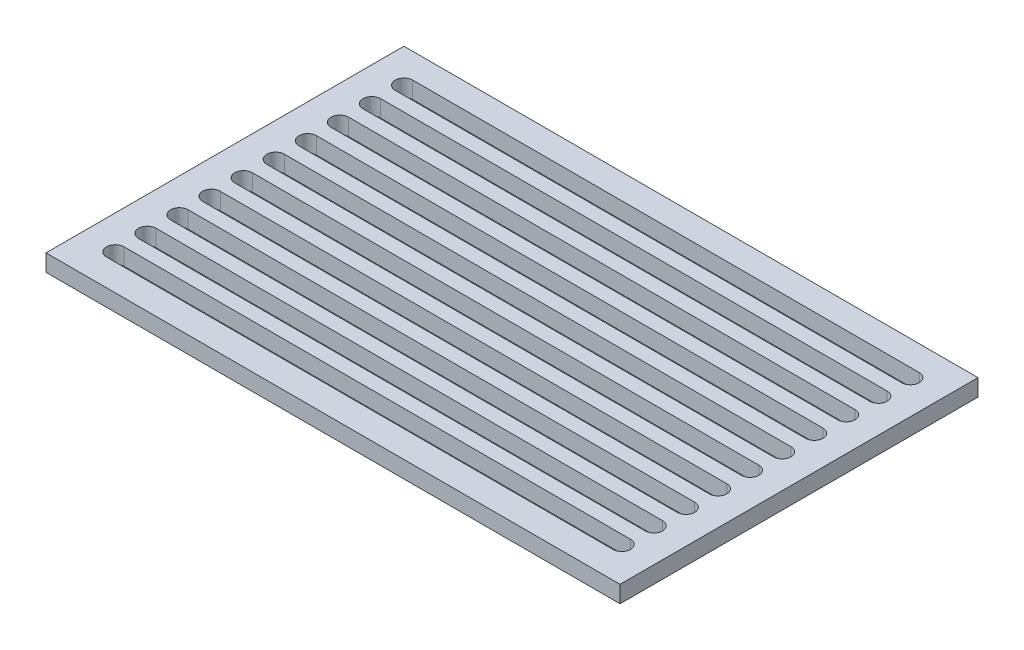
from build123d import *

# Parameters (mm, degrees)
SKETCH1_W           = 170
SKETCH1_H           = 106
BOSS_EXTRUDE1_DEPTH = 5
CUT_EXTRUDE2_REACH  = 202.402


with BuildPart() as part:
    # Sketch1 → Boss-Extrude1 (new body)
    with BuildSketch(Plane(origin=(0, 0, 0), x_dir=(1, 0, 0), z_dir=(0, 1, 0))):
        with Locations((85, 53)):
            Rectangle(SKETCH1_W, SKETCH1_H)
    extrude(amount=BOSS_EXTRUDE1_DEPTH)

    # Sketch2 → Cut-Extrude2 (cut, up to next)
    with BuildSketch(Plane(origin=(0, 5, 0), x_dir=(1, 0, 0), z_dir=(0, 1, 0)), mode=Mode.PRIVATE) as cut_extrude2_sk1:
        with BuildLine():
            Line((10, 98.605263158), (160, 98.605263158))
            ThreePointArc((160, 98.605263158), (162.605263158, 96), (160, 93.394736842))
            Line((160, 93.394736842), (10, 93.394736842))
            ThreePointArc((10, 93.394736842), (7.394736842, 96), (10, 98.605263158))
        make_face()
    cut_extrude2_tool1 = extrude(cut_extrude2_sk1.sketch, amount=-CUT_EXTRUDE2_REACH, mode=Mode.PRIVATE) & part.part
    # Sketch2 → Cut-Extrude2 (cut, up to next)
    with BuildSketch(Plane(origin=(0, 5, 0), x_dir=(1, 0, 0), z_dir=(0, 1, 0)), mode=Mode.PRIVATE) as cut_extrude2_sk2:
        with BuildLine():
            Line((10, 89.105263158), (160, 89.105263158))
            ThreePointArc((160, 89.105263158), (162.605263158, 86.5), (160, 83.894736842))
            Line((160, 83.894736842), (10, 83.894736842))
            ThreePointArc((10, 83.894736842), (7.394736842, 86.5), (10, 89.105263158))
        make_face()
    cut_extrude2_tool2 = extrude(cut_extrude2_sk2.sketch, amount=-CUT_EXTRUDE2_REACH, mode=Mode.PRIVATE) & part.part
    # Sketch2 → Cut-Extrude2 (cut, up to next)
    with BuildSketch(Plane(origin=(0, 5, 0), x_dir=(1, 0, 0), z_dir=(0, 1, 0)), mode=Mode.PRIVATE) as cut_extrude2_sk3:
        with BuildLine():
            Line((10, 79.605263158), (160, 79.605263158))
            ThreePointArc((160, 79.605263158), (162.605263158, 77), (160, 74.394736842))
            Line((160, 74.394736842), (10, 74.394736842))
            ThreePointArc((10, 74.394736842), (7.394736842, 77), (10, 79.605263158))
        make_face()
    cut_extrude2_tool3 = extrude(cut_extrude2_sk3.sketch, amount=-CUT_EXTRUDE2_REACH, mode=Mode.PRIVATE) & part.part
    # Sketch2 → Cut-Extrude2 (cut, up to next)
    with BuildSketch(Plane(origin=(0, 5, 0), x_dir=(1, 0, 0), z_dir=(0, 1, 0)), mode=Mode.PRIVATE) as cut_extrude2_sk4:
        with BuildLine():
            Line((10, 70.105263158), (160, 70.105263158))
            ThreePointArc((160, 70.105263158), (162.605263158, 67.5), (160, 64.894736842))
            Line((160, 64.894736842), (10, 64.894736842))
            ThreePointArc((10, 64.894736842), (7.394736842, 67.5), (10, 70.105263158))
        make_face()
    cut_extrude2_tool4 = extrude(cut_extrude2_sk4.sketch, amount=-CUT_EXTRUDE2_REACH, mode=Mode.PRIVATE) & part.part
    # Sketch2 → Cut-Extrude2 (cut, up to next)
    with BuildSketch(Plane(origin=(0, 5, 0), x_dir=(1, 0, 0), z_dir=(0, 1, 0)), mode=Mode.PRIVATE) as cut_extrude2_sk5:
        with BuildLine():
            Line((10, 60.605263158), (160, 60.605263158))
            ThreePointArc((160, 60.605263158), (162.605263158, 58), (160, 55.394736842))
            Line((160, 55.394736842), (10, 55.394736842))
            ThreePointArc((10, 55.394736842), (7.394736842, 58), (10, 60.605263158))
        make_face()
    cut_extrude2_tool5 = extrude(cut_extrude2_sk5.sketch, amount=-CUT_EXTRUDE2_REACH, mode=Mode.PRIVATE) & part.part
    # Sketch2 → Cut-Extrude2 (cut, up to next)
    with BuildSketch(Plane(origin=(0, 5, 0), x_dir=(1, 0, 0), z_dir=(0, 1, 0)), mode=Mode.PRIVATE) as cut_extrude2_sk6:
        with BuildLine():
            Line((10, 51.105263158), (160, 51.105263158))
            ThreePointArc((160, 51.105263158), (162.605263158, 48.5), (160, 45.894736842))
            Line((160, 45.894736842), (10, 45.894736842))
            ThreePointArc((10, 45.894736842), (7.394736842, 48.5), (10, 51.105263158))
        make_face()
    cut_extrude2_tool6 = extrude(cut_extrude2_sk6.sketch, amount=-CUT_EXTRUDE2_REACH, mode=Mode.PRIVATE) & part.part
    # Sketch2 → Cut-Extrude2 (cut, up to next)
    with BuildSketch(Plane(origin=(0, 5, 0), x_dir=(1, 0, 0), z_dir=(0, 1, 0)), mode=Mode.PRIVATE) as cut_extrude2_sk7:
        with BuildLine():
            Line((10, 41.605263158), (160, 41.605263158))
            ThreePointArc((160, 41.605263158), (162.605263158, 39), (160, 36.394736842))
            Line((160, 36.394736842), (10, 36.394736842))
            ThreePointArc((10, 36.394736842), (7.394736842, 39), (10, 41.605263158))
        make_face()
    cut_extrude2_tool7 = extrude(cut_extrude2_sk7.sketch, amount=-CUT_EXTRUDE2_REACH, mode=Mode.PRIVATE) & part.part
    # Sketch2 → Cut-Extrude2 (cut, up to next)
    with BuildSketch(Plane(origin=(0, 5, 0), x_dir=(1, 0, 0), z_dir=(0, 1, 0)), mode=Mode.PRIVATE) as cut_extrude2_sk8:
        with BuildLine():
            Line((10, 32.105263158), (160, 32.105263158))
            ThreePointArc((160, 32.105263158), (162.605263158, 29.5), (160, 26.894736842))
            Line((160, 26.894736842), (10, 26.894736842))
            ThreePointArc((10, 26.894736842), (7.394736842, 29.5), (10, 32.105263158))
        make_face()
    cut_extrude2_tool8 = extrude(cut_extrude2_sk8.sketch, amount=-CUT_EXTRUDE2_REACH, mode=Mode.PRIVATE) & part.part
    # Sketch2 → Cut-Extrude2 (cut, up to next)
    with BuildSketch(Plane(origin=(0, 5, 0), x_dir=(1, 0, 0), z_dir=(0, 1, 0)), mode=Mode.PRIVATE) as cut_extrude2_sk9:
        with BuildLine():
            Line((10, 22.605263158), (160, 22.605263158))
            ThreePointArc((160, 22.605263158), (162.605263158, 20), (160, 17.394736842))
            Line((160, 17.394736842), (10, 17.394736842))
            ThreePointArc((10, 17.394736842), (7.394736842, 20), (10, 22.605263158))
        make_face()
    cut_extrude2_tool9 = extrude(cut_extrude2_sk9.sketch, amount=-CUT_EXTRUDE2_REACH, mode=Mode.PRIVATE) & part.part
    # Sketch2 → Cut-Extrude2 (cut, up to next)
    with BuildSketch(Plane(origin=(0, 5, 0), x_dir=(1, 0, 0), z_dir=(0, 1, 0)), mode=Mode.PRIVATE) as cut_extrude2_sk10:
        with BuildLine():
            Line((10, 13.105263158), (160, 13.105263158))
            ThreePointArc((160, 13.105263158), (162.605263158, 10.5), (160, 7.894736842))
            Line((160, 7.894736842), (10, 7.894736842))
            ThreePointArc((10, 7.894736842), (7.394736842, 10.5), (10, 13.105263158))
        make_face()
    cut_extrude2_tool10 = extrude(cut_extrude2_sk10.sketch, amount=-CUT_EXTRUDE2_REACH, mode=Mode.PRIVATE) & part.part
    add(cut_extrude2_tool1.solids().sort_by_distance((85, 5, -96))[0], mode=Mode.SUBTRACT)
    add(cut_extrude2_tool2.solids().sort_by_distance((85, 5, -86.5))[0], mode=Mode.SUBTRACT)
    add(cut_extrude2_tool3.solids().sort_by_distance((85, 5, -77))[0], mode=Mode.SUBTRACT)
    add(cut_extrude2_tool4.solids().sort_by_distance((85, 5, -67.5))[0], mode=Mode.SUBTRACT)
    add(cut_extrude2_tool5.solids().sort_by_distance((85, 5, -58))[0], mode=Mode.SUBTRACT)
    add(cut_extrude2_tool6.solids().sort_by_distance((85, 5, -48.5))[0], mode=Mode.SUBTRACT)
    add(cut_extrude2_tool7.solids().sort_by_distance((85, 5, -39))[0], mode=Mode.SUBTRACT)
    add(cut_extrude2_tool8.solids().sort_by_distance((85, 5, -29.5))[0], mode=Mode.SUBTRACT)
    add(cut_extrude2_tool9.solids().sort_by_distance((85, 5, -20))[0], mode=Mode.SUBTRACT)
    add(cut_extrude2_tool10.solids().sort_by_distance((85, 5, -10.5))[0], mode=Mode.SUBTRACT)


solid = part.part
